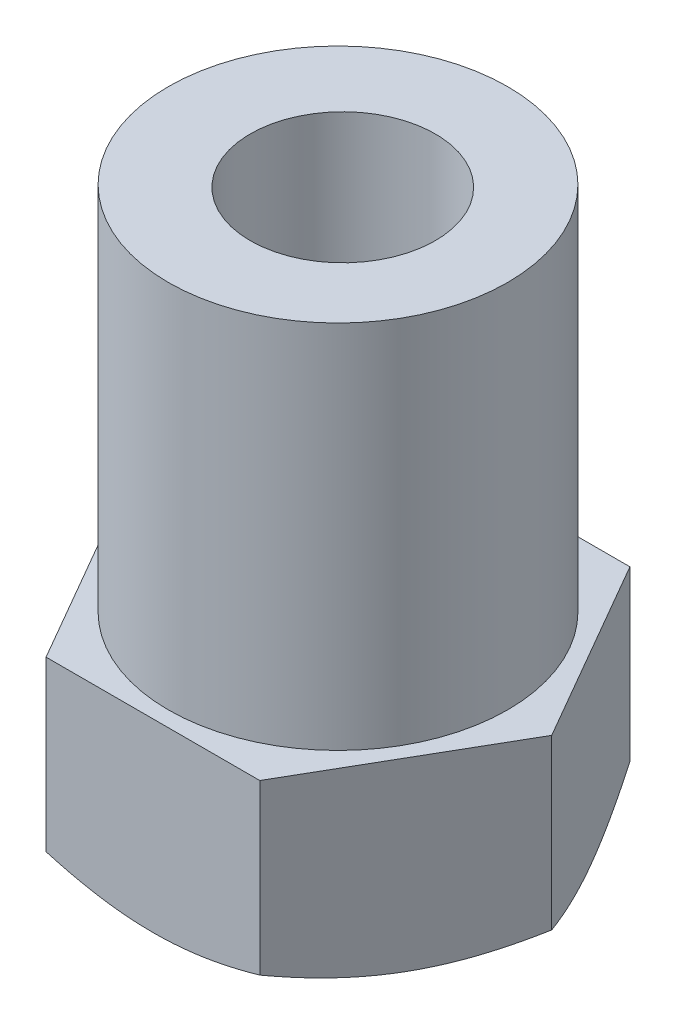
from build123d import *

# Parameters (mm, degrees)
EXTRUDE_1_DEPTH     = 6
SKETCH_2_R          = 5.5
EXTRUDE_2_DEPTH     = 12
SKETCH_3_R          = 3
CUT_EXTRUDE_1_DEPTH = 21.199009877
SKETCH_4_OUTSIDE_W  = 55.636
SKETCH_4_OUTSIDE_H  = 53.78
SKETCH_4_OUTSIDE_R  = 6
CUT_EXTRUDE_2_DEPTH = 10
CUT_EXTRUDE_2_DRAFT = -60


with BuildPart() as part:
    # 草图1 → 凸台-拉伸1 (new body)
    with BuildSketch(Plane(origin=(0, 0, 0), x_dir=(1, 0, 0), z_dir=(0, 1, 0))):
        Polygon((6.92820323, 0), (3.464101615, 6), (-3.464101615, 6), (-6.92820323, 0), (-3.464101615, -6), (3.464101615, -6), align=None)
    extrude(amount=EXTRUDE_1_DEPTH)

    # 草图2 → 凸台-拉伸2 (add)
    with BuildSketch(Plane(origin=(0, 6, 0), x_dir=(1, 0, 0), z_dir=(0, 1, 0))):
        with Locations(Location((0, 0, 0), (0, 0, 270))):
            Circle(SKETCH_2_R)
    extrude(amount=EXTRUDE_2_DEPTH)

    # 草图3 → 切除-拉伸1 (cut, through all)
    with BuildSketch(Plane(origin=(0, 18, 0), x_dir=(1, 0, 0), z_dir=(0, 1, 0))):
        with Locations(Location((0.154901244, 0, 0), (0, 0, 270))):
            Circle(SKETCH_3_R)
    extrude(amount=-CUT_EXTRUDE_1_DEPTH, mode=Mode.SUBTRACT)


with BuildPart() as cut_extrude_2_tool:
    # 草图4 outside → 切除-拉伸2 (with draft: the straight prism first)
    with BuildSketch(Plane.XZ):
        Rectangle(SKETCH_4_OUTSIDE_W, SKETCH_4_OUTSIDE_H)
        Circle(SKETCH_4_OUTSIDE_R, mode=Mode.SUBTRACT)
    extrude(amount=-CUT_EXTRUDE_2_DEPTH)
    # 切除-拉伸2: the draft: its side faces are tilted about the plane it starts from
    cut_extrude_2_sides = [cut_extrude_2_tool.faces().sort_by_distance(p)[0] for p in [
        (0, 5, -26.89),
        (27.818, 5, 0),
        (0, 5, 26.89),
        (-27.818, 5, 0),
        (-6, 5, 0),
    ]]
    draft(cut_extrude_2_sides, Plane.XZ, CUT_EXTRUDE_2_DRAFT)


with BuildPart() as part_1:
    add(part.part)

    # 切除-拉伸2: cut by cut_extrude_2_tool
    add(cut_extrude_2_tool.part, mode=Mode.SUBTRACT)


solid = part_1.part
